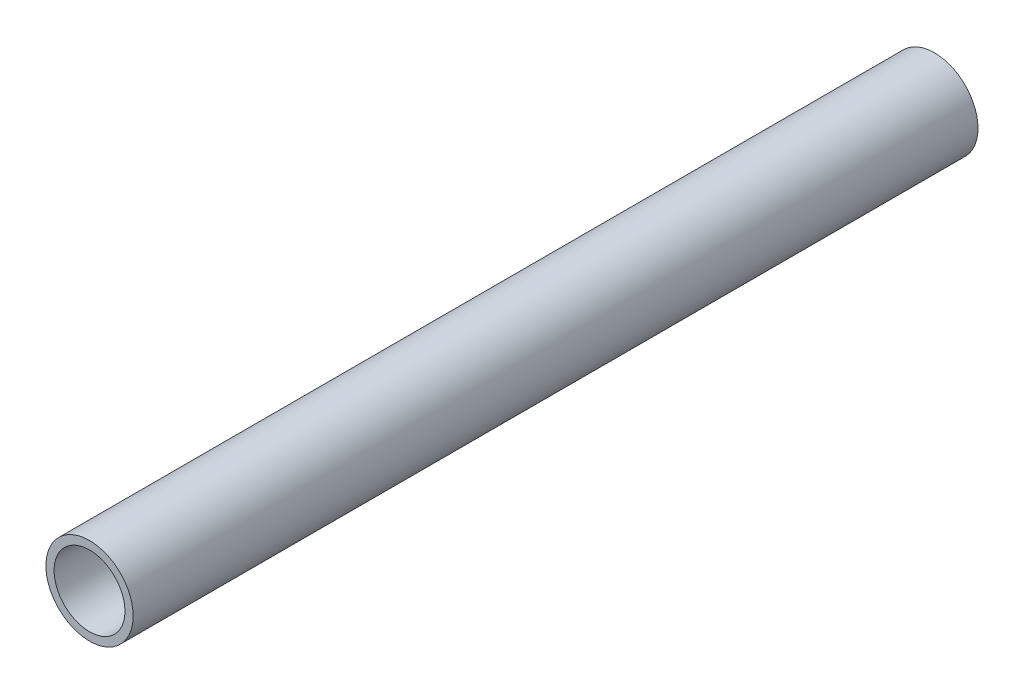
from build123d import *

# Parameters (mm, degrees)
SKETCH_1_R      = 8
SKETCH_1_R_2    = 6.5
EXTRUDE_1_DEPTH = 155


with BuildPart() as part:
    # 草图1 → 凸台-拉伸1 (new body)
    with BuildSketch(Plane.XY):
        Circle(SKETCH_1_R)
        Circle(SKETCH_1_R_2, mode=Mode.SUBTRACT)
    extrude(amount=EXTRUDE_1_DEPTH)


solid = part.part
